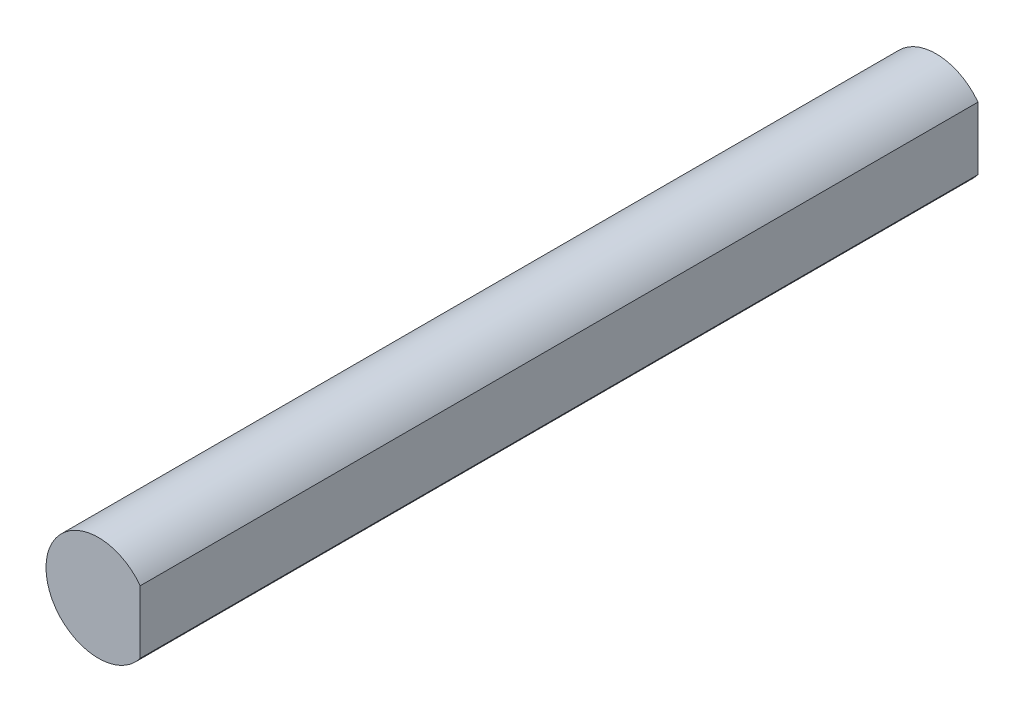
from build123d import *

# Parameters (mm, degrees)
ESQUISSE1_R             = 3.175
BOSS_EXTRU_1_DEPTH      = 50.8
ENL_V_MAT_EXTRU_1_REACH = 52.998
ESQUISSE2_W             = 2.080530409
ESQUISSE2_H             = 6.434232931


with BuildPart() as part:
    # Esquisse1 → Boss.-Extru.1 (new body)
    with BuildSketch(Plane.XY):
        Circle(ESQUISSE1_R)
    extrude(amount=BOSS_EXTRU_1_DEPTH)

    # Esquisse2 → Enlèv. mat.-Extru.1 (cut, up to next)
    with BuildSketch(Plane(origin=(0, 0, 0), x_dir=(-1, 0, 0), z_dir=(0, 0, -1)), mode=Mode.PRIVATE) as enl_v_mat_extru_1_sk1:
        with Locations((-3.580265205, -0.067424596)):
            Rectangle(ESQUISSE2_W, ESQUISSE2_H)
    enl_v_mat_extru_1_tool1 = extrude(enl_v_mat_extru_1_sk1.sketch, amount=-ENL_V_MAT_EXTRU_1_REACH, mode=Mode.PRIVATE) & part.part
    add(enl_v_mat_extru_1_tool1.solids().sort_by_distance((3.580265, -0.067425, 0))[0], mode=Mode.SUBTRACT)


solid = part.part
